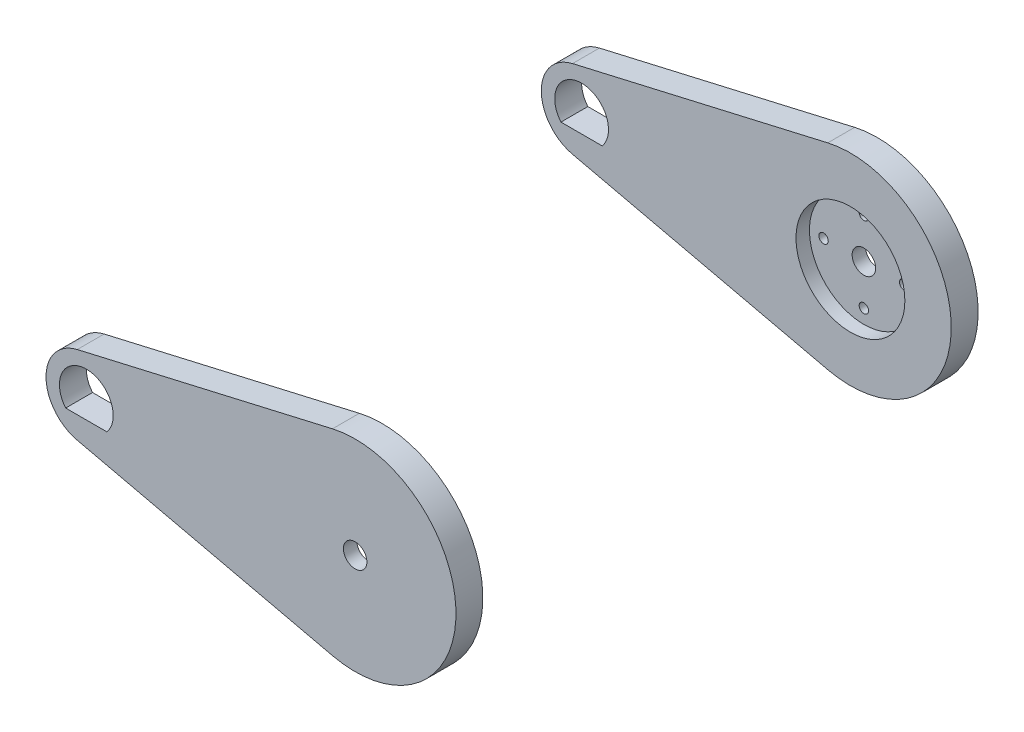
from build123d import *

# Parameters (mm, degrees)
SKETCH1_R           = 15
SKETCH1_R_2         = 8.1
BOSS_EXTRUDE1_DEPTH = 4
SKETCH1_3_R         = 8.1
SKETCH1_3_R_2       = 1.75
BOSS_EXTRUDE2_DEPTH = 2
BOSS_EXTRUDE3_DEPTH = 4
SKETCH3_R           = 0.7
CUT_EXTRUDE1_DEPTH  = 10


with BuildPart() as part:
    # Sketch1 → Boss-Extrude1 (new body)
    with BuildSketch(Plane.XY):
        Circle(SKETCH1_R)
        Circle(SKETCH1_R_2, mode=Mode.SUBTRACT)
    extrude(amount=BOSS_EXTRUDE1_DEPTH)

    # Sketch1<3> → Boss-Extrude2 (add)
    with BuildSketch(Plane.XY):
        Circle(SKETCH1_3_R)
        Circle(SKETCH1_3_R_2, mode=Mode.SUBTRACT)
    extrude(amount=BOSS_EXTRUDE2_DEPTH)

    # Sketch2 → Boss-Extrude3 (add)
    with BuildSketch(Plane.XY):
        with BuildLine():
            Line((-3.375, 14.615381452), (-41.35, 5.846152581))
            ThreePointArc((-41.35, 5.846152581), (-46, 0), (-41.35, -5.846152581))
            Line((-41.35, -5.846152581), (-3.375, -14.615381452))
            ThreePointArc((-3.375, -14.615381452), (-15, 0), (-3.375, 14.615381452))
        make_face()
        with BuildLine():
            Line((-36.925, -2.558197608), (-43.075, -2.558197608))
            ThreePointArc((-43.075, -2.558197608), (-40, 4), (-36.925, -2.558197608))
        make_face(mode=Mode.SUBTRACT)
    extrude(amount=BOSS_EXTRUDE3_DEPTH)


with BuildPart() as body_2:
    # Mirror2: mirrored copy
    add(part.part.mirror(Plane.XY.offset(38.847994838)))


with BuildPart() as part_1:
    add(part.part)

    # Sketch3 → Cut-Extrude1 (cut)
    with BuildSketch(Plane.XY.offset(2)):
        with Locations((0, 6)):
            Circle(SKETCH3_R)
        with Locations((6, 0)):
            Circle(SKETCH3_R)
        with Locations((0, -6)):
            Circle(SKETCH3_R)
        with Locations((-6, 0)):
            Circle(SKETCH3_R)
    extrude(amount=-CUT_EXTRUDE1_DEPTH, mode=Mode.SUBTRACT)


solid = Compound([body_2.part, part_1.part])
